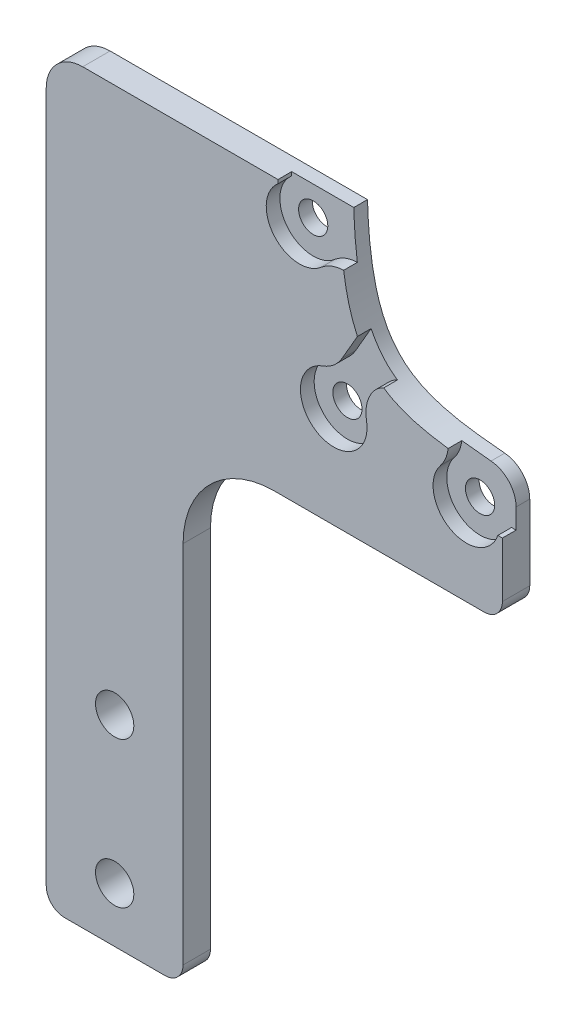
from build123d import *

# Parameters (mm, degrees)
BOSS_EXTRUDE3_DEPTH = 3
FILLET1_R           = 2
SKETCH12_R          = 2.1
CUT_EXTRUDE5_DEPTH  = 10
FILLET5_R           = 4
FILLET6_R           = 3
FILLET7_R           = 10
CUT_EXTRUDE9_DEPTH  = 1.5
SKETCH17_W          = 7.951649766
SKETCH17_H          = 5.272619773
SKETCH17_W_2        = 3.894064167
SKETCH17_H_2        = 6.195846789
CUT_EXTRUDE10_DEPTH = 1.5
SKETCH18_R          = 1.6
CUT_EXTRUDE11_DEPTH = 10


with BuildPart() as part:
    # Sketch8 → Boss-Extrude3 (new body)
    with BuildSketch(Plane.XY):
        with BuildLine():
            Line((-4.848101441, -13.321505966), (-4.848101441, -0.321505966))
            add(Edge.make_bspline(
                [(-22.634292007, 16.445697007), (-22.442914483, 9.994307564), (-20.126223523, 0.876298034), (-11.53370308, 0.191019868), (-4.848101441, -0.321505966)],
                knots=[0, 0, 0, 0, 0.444535858, 1, 1, 1, 1], degree=3))
            Line((-22.634292007, 16.445697007), (-54.848101441, 16.445697007))
            Line((-54.848101441, 16.445697007), (-54.848101441, -65.321505966))
            Line((-54.848101441, -65.321505966), (-39.848101441, -65.321505966))
            Line((-39.848101441, -65.321505966), (-39.848101441, -13.321505966))
            Line((-39.848101441, -13.321505966), (-4.848101441, -13.321505966))
        make_face()
    extrude(amount=-BOSS_EXTRUDE3_DEPTH)

    # Fillet1
    fillet1_edges = [part.edges().sort_by_distance(p)[0] for p in [
        (-4.848101441, -13.321505966, -1.5),
        (-39.848101441, -65.321505966, -1.5),
        (-54.848101441, -65.321505966, -1.5),
    ]]
    fillet(fillet1_edges, radius=FILLET1_R)

    # Sketch12 → Cut-Extrude5 (cut)
    with BuildSketch(Plane.XY):
        with Locations((-47.348101441, -43.321505966)):
            Circle(SKETCH12_R)
        with Locations((-47.348101441, -59.321505966)):
            Circle(SKETCH12_R)
    extrude(amount=-CUT_EXTRUDE5_DEPTH, mode=Mode.SUBTRACT)

    # Fillet5
    fillet5_edges = [part.edges().sort_by_distance(p)[0] for p in [
        (-54.848101441, 16.445697007, -1.5),
    ]]
    fillet(fillet5_edges, radius=FILLET5_R)

    # Fillet6
    fillet6_edges = [part.edges().sort_by_distance(p)[0] for p in [
        (-4.848101441, -0.321505966, -1.5),
    ]]
    fillet(fillet6_edges, radius=FILLET6_R)

    # Fillet7
    fillet7_edges = [part.edges().sort_by_distance(p)[0] for p in [
        (-39.848101441, -13.321505966, -1.5),
    ]]
    fillet(fillet7_edges, radius=FILLET7_R)

    # Sketch16 → Cut-Extrude9 (cut)
    with BuildSketch(Plane.XY):
        with BuildLine():
            Line((-9.100213088, 21.316177145), (-9.209573917, 22.566177145))
            Line((-9.209573917, 22.566177145), (-11.640691005, 22.566177145))
            add(Edge.make_bspline(
                [(-11.640691005, 22.566177145), (-15.022495372, 19.340372794), (-15.924452017, 14.756685891)],
                knots=[0, 0, 0, 1, 1, 1], degree=2))
            ThreePointArc((-15.924452017, 14.756685891), (-15.222749011, 12.914891859), (-16.441177254, 11.365690457))
            add(Edge.make_bspline(
                [(-14.837210154, 6.041686336), (-16.459215455, 8.47618894), (-16.441177254, 11.365690457)],
                knots=[0, 0, 0, 1, 1, 1], degree=2))
            ThreePointArc((-14.837210154, 6.041686336), (-13.061711204, 6.261247316), (-11.820884577, 4.972467727))
            Line((-11.820884577, 4.972467727), (-6.820884577, 4.972467727))
            Line((-6.820884577, 4.972467727), (-6.820884577, 0.680172774))
            ThreePointArc((-6.820884577, 0.680172774), (-6.595588162, -0.64331234), (-5.945078154, -1.817709228))
            ThreePointArc((-5.945078154, -1.817709228), (-8.795904792, -7.747026555), (-11.646731431, -1.817709228))
            ThreePointArc((-11.646731431, -1.817709228), (-10.996221423, -0.64331234), (-10.770925007, 0.680172774))
            Line((-10.770925007, 0.680172774), (-10.770925007, 2.723195944))
            Line((-10.770925007, 2.723195944), (-12.604024539, 2.723195944))
            ThreePointArc((-12.604024539, 2.723195944), (-13.729925577, 2.376177145), (-14.855826616, 2.723195944))
            Line((-14.855826616, 2.723195944), (-16.623775808, 2.723195944))
            ThreePointArc((-16.623775808, 2.723195944), (-18.123775808, 2.321272155), (-19.22185202, 1.223195944))
            Line((-19.22185202, 1.223195944), (-19.272943939, 1.134702143))
            ThreePointArc((-19.272943939, 1.134702143), (-19.750526635, -0.18476513), (-19.743016315, -1.587983826))
            ThreePointArc((-19.743016315, -1.587983826), (-25.157950081, -5.408427498), (-24.556815691, 1.19126454))
            ThreePointArc((-24.556815691, 1.19126454), (-23.337837493, 1.88636976), (-22.433936663, 2.959702143))
            Line((-22.433936663, 2.959702143), (-19.683732235, 7.723195944))
            add(Edge.make_bspline(
                [(-19.683732235, 7.723195944), (-19.261177539, 8.547983183), (-18.924513654, 9.521118545), (-19.229981569, 11.075334784), (-20.358554935, 11.423731791), (-20.93203262, 11.430328812)],
                knots=[0, 0, 0, 0, 0.295584427, 0.638506801, 1, 1, 1, 1], degree=3))
            Line((-20.93203262, 11.430328812), (-22.12642518, 11.430328812))
            ThreePointArc((-22.12642518, 11.430328812), (-23.507908706, 11.184193923), (-24.719376585, 10.476080446))
            ThreePointArc((-24.719376585, 10.476080446), (-30.735444741, 13.255328812), (-24.719376585, 16.034577178))
            ThreePointArc((-24.719376585, 16.034577178), (-23.507908706, 15.326463702), (-22.12642518, 15.080328812))
            Line((-22.12642518, 15.080328812), (-20.976183849, 15.080328812))
            ThreePointArc((-20.976183849, 15.080328812), (-18.688287573, 15.799242006), (-17.222790707, 17.697563496))
            add(Edge.make_bspline(
                [(-11.640691005, 24.566177145), (-14.244308048, 22.933045591), (-16.184240838, 20.516614501), (-17.222790707, 17.697563496)],
                knots=[0, 0, 0, 0, 0.773209578, 0.773209578, 0.773209578, 0.773209578], degree=3))
            Line((-11.640691005, 24.566177145), (-8.140691005, 24.566177145))
            Line((-8.140691005, 24.566177145), (-8.140691005, 22.568020283))
            Line((-8.140691005, 22.568020283), (-8.250213088, 21.316177145))
            Line((-8.250213088, 21.316177145), (-9.100213088, 21.316177145))
        make_face()
    extrude(amount=-CUT_EXTRUDE9_DEPTH, mode=Mode.SUBTRACT)

    # Sketch17 → Cut-Extrude10 (cut)
    with BuildSketch(Plane.XY):
        with Locations((-25.46861182, 15.757865506)):
            Rectangle(SKETCH17_W, SKETCH17_H)
        with Locations((-5.398647621, -2.193777117)):
            Rectangle(SKETCH17_W_2, SKETCH17_H_2)
    extrude(amount=-CUT_EXTRUDE10_DEPTH, mode=Mode.SUBTRACT)

    # Sketch18 → Cut-Extrude11 (cut)
    with BuildSketch(Plane.XY.offset(-1.5)):
        with Locations((-27.085444741, 13.255328812)):
            Circle(SKETCH18_R)
        with Locations((-23.332950081, -2.247434774)):
            Circle(SKETCH18_R)
        with Locations((-8.795904792, -4.097026555)):
            Circle(SKETCH18_R)
    extrude(amount=-CUT_EXTRUDE11_DEPTH, mode=Mode.SUBTRACT)


solid = part.part
